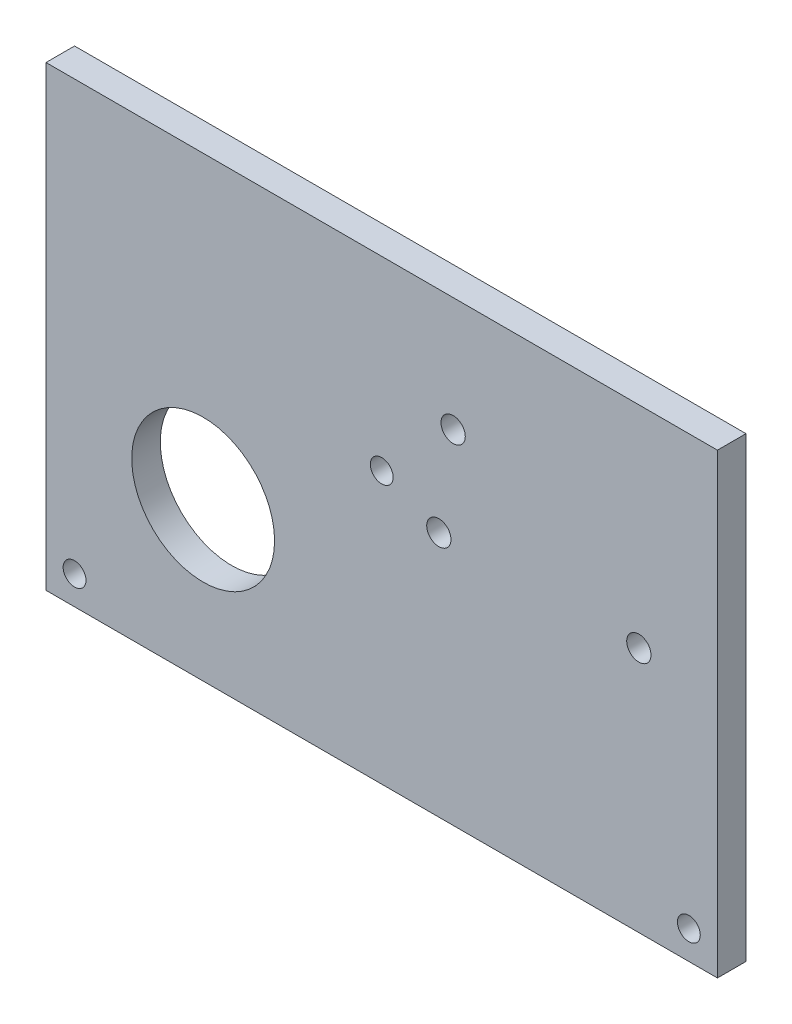
from build123d import *

# Parameters (mm, degrees)
SKETCH_1_W      = 94
SKETCH_1_H      = 64
SKETCH_1_R      = 10
SKETCH_1_R_2    = 1.7
SKETCH_1_R_3    = 1.6
EXTRUDE_1_DEPTH = 2


with BuildPart() as part:
    # 草图1 → 凸台-拉伸1 (new, symmetric)
    with BuildSketch(Plane.XY):
        with Locations((-45, 102)):
            Rectangle(SKETCH_1_W, SKETCH_1_H)
        with Locations((-70, 92)):
            Circle(SKETCH_1_R, mode=Mode.SUBTRACT)
        with Locations((-35, 118)):
            Circle(SKETCH_1_R_2, mode=Mode.SUBTRACT)
        with Locations((-9, 104.5)):
            Circle(SKETCH_1_R_2, mode=Mode.SUBTRACT)
        with Locations((-37, 104.5)):
            Circle(SKETCH_1_R_2, mode=Mode.SUBTRACT)
        with Locations((-88, 74)):
            Circle(SKETCH_1_R_3, mode=Mode.SUBTRACT)
        with Locations((-2, 74)):
            Circle(SKETCH_1_R_3, mode=Mode.SUBTRACT)
        with Locations((-45, 108)):
            Circle(SKETCH_1_R_3, mode=Mode.SUBTRACT)
    extrude(amount=EXTRUDE_1_DEPTH, both=True)


solid = part.part
